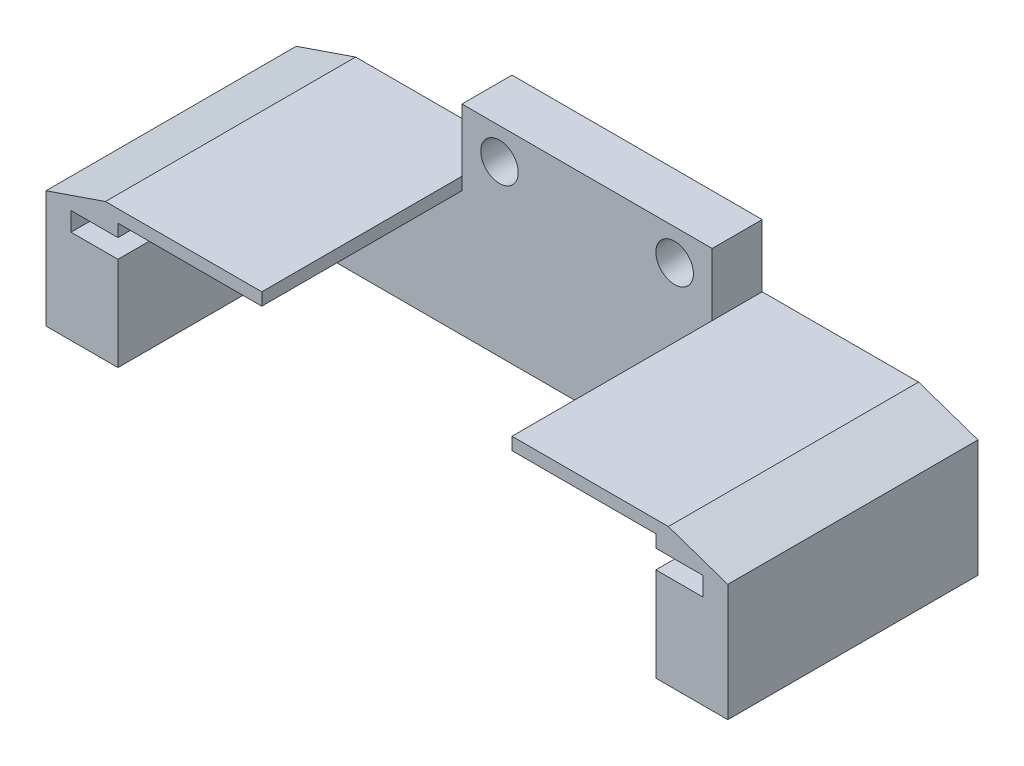
from build123d import *

# Parameters (mm, degrees)
CROQUIS1_W              = 51
CROQUIS1_H              = 17
SALIENTE_EXTRUIR1_DEPTH = 17
CROQUIS2_W              = 15
CROQUIS2_H              = 16
CORTAR_EXTRUIR1_DEPTH   = 17
CROQUIS3_W              = 43
CROQUIS3_H              = 10
CORTAR_EXTRUIR2_DEPTH   = 16
CROQUIS6_W              = 50.5
CROQUIS6_H              = 1.5
CORTAR_EXTRUIR4_DEPTH   = 16
CORTAR_EXTRUIR5_START   = -17
CROQUIS7_W              = 6
CROQUIS7_H              = 6
CROQUIS7_W_2            = 20
CROQUIS7_H_2            = 7
CORTAR_EXTRUIR5_DEPTH   = 17
CORTAR_EXTRUIR6_START   = -39
CROQUIS8_W              = 10
CROQUIS8_H              = 6
CORTAR_EXTRUIR6_DEPTH   = 39
CROQUIS10_W             = 17
CROQUIS10_H             = 11
SALIENTE_EXTRUIR4_DEPTH = 1
CROQUIS11_W             = 17
CROQUIS11_H             = 11
SALIENTE_EXTRUIR5_DEPTH = 1
CORTAR_EXTRUIR7_START   = -17
CORTAR_EXTRUIR7_DEPTH   = 17
CROQUIS13_W             = 9.5
CROQUIS13_H             = 6
CORTAR_EXTRUIR8_DEPTH   = 7
SALIENTE_EXTRUIR6_DEPTH = 3
CROQUIS16_W             = 20
CROQUIS16_H             = 4
SALIENTE_EXTRUIR7_DEPTH = 6
CROQUIS17_R             = 1.5
CORTAR_EXTRUIR9_DEPTH   = 4
CROQUIS20_W             = 20
CROQUIS20_H             = 9.628571429
SALIENTE_EXTRUIR8_DEPTH = 0.75
CROQUIS21_W             = 20
CROQUIS21_H             = 9.628571429
SALIENTE_EXTRUIR9_DEPTH = 0.75
CORTAR_EXTRUIR10_START  = -20
CORTAR_EXTRUIR10_DEPTH  = 20


with BuildPart() as part:
    # Croquis1 → Saliente-Extruir1 (new body)
    with BuildSketch(Plane.XY):
        with Locations((-29.407991935, 18.612308998)):
            Rectangle(CROQUIS1_W, CROQUIS1_H)
    extrude(amount=SALIENTE_EXTRUIR1_DEPTH)

    # Croquis2 → Cortar-Extruir1 (cut)
    with BuildSketch(Plane.XZ.offset(-10.112308998)):
        with Locations((-29.407991935, 9)):
            Rectangle(CROQUIS2_W, CROQUIS2_H)
    extrude(amount=-CORTAR_EXTRUIR1_DEPTH, mode=Mode.SUBTRACT)

    # Croquis3 → Cortar-Extruir2 (cut)
    with BuildSketch(Plane.XY.offset(17)):
        with Locations((-29.407991935, 15.112308998)):
            Rectangle(CROQUIS3_W, CROQUIS3_H)
    extrude(amount=-CORTAR_EXTRUIR2_DEPTH, mode=Mode.SUBTRACT)

    # Croquis6 → Cortar-Extruir4 (cut)
    with BuildSketch(Plane.XY.offset(17)):
        with Locations((-29.407991935, 18.362308998)):
            Rectangle(CROQUIS6_W, CROQUIS6_H)
    extrude(amount=-CORTAR_EXTRUIR4_DEPTH, mode=Mode.SUBTRACT)

    # Croquis7 → Cortar-Extruir5 (cut)
    with BuildSketch(Plane.XY.offset(17).offset(CORTAR_EXTRUIR5_START)):
        with Locations((-6.907991935, 24.112308998)):
            Rectangle(CROQUIS7_W, CROQUIS7_H)
        with Locations((-51.907991935, 24.112308998)):
            Rectangle(CROQUIS7_W, CROQUIS7_H)
        with Locations((-29.407991935, 23.612308998)):
            Rectangle(CROQUIS7_W_2, CROQUIS7_H_2)
    extrude(amount=CORTAR_EXTRUIR5_DEPTH, mode=Mode.SUBTRACT)

    # Croquis8 → Cortar-Extruir6 (cut)
    with BuildSketch(Plane(origin=(-9.907991935, 0, 0), x_dir=(0, 0, -1), z_dir=(1, 0, 0)).offset(CORTAR_EXTRUIR6_START)):
        with Locations((-5, 24.112308998)):
            Rectangle(CROQUIS8_W, CROQUIS8_H)
    extrude(amount=CORTAR_EXTRUIR6_DEPTH, mode=Mode.SUBTRACT)

    # Croquis10 → Saliente-Extruir4 (add)
    with BuildSketch(Plane.ZY.offset(54.907991935)):
        with Locations((8.5, 15.612308998)):
            Rectangle(CROQUIS10_W, CROQUIS10_H)
    extrude(amount=SALIENTE_EXTRUIR4_DEPTH)

    # Croquis11 → Saliente-Extruir5 (add)
    with BuildSketch(Plane(origin=(-3.907991935, 0, 0), x_dir=(0, 0, -1), z_dir=(1, 0, 0))):
        with Locations((-8.5, 15.612308998)):
            Rectangle(CROQUIS11_W, CROQUIS11_H)
    extrude(amount=SALIENTE_EXTRUIR5_DEPTH)

    # Croquis12 → Cortar-Extruir7 (cut)
    with BuildSketch(Plane.XY.offset(17).offset(CORTAR_EXTRUIR7_START)):
        Polygon((-55.907991935, 21.112308998), (-51.907991935, 21.112308998), (-55.907991935, 19.740880427), align=None)
        Polygon((-2.907991935, 21.112308998), (-6.907991935, 21.112308998), (-2.907991935, 19.740880427), align=None)
    extrude(amount=CORTAR_EXTRUIR7_DEPTH, mode=Mode.SUBTRACT)

    # Croquis13 → Cortar-Extruir8 (cut)
    with BuildSketch(Plane.XY.offset(17)):
        with Locations((-44.157991935, 24.112308998)):
            Rectangle(CROQUIS13_W, CROQUIS13_H)
        with Locations((-14.657991935, 24.112308998)):
            Rectangle(CROQUIS13_W, CROQUIS13_H)
    extrude(amount=-CORTAR_EXTRUIR8_DEPTH, mode=Mode.SUBTRACT)

    # Croquis14 → Saliente-Extruir6 (add)
    with BuildSketch(Plane(origin=(0, 0, 0), x_dir=(-1, 0, 0), z_dir=(0, 0, -1))):
        Polygon((55.907991935, 10.112308998), (55.907991935, 19.740880427), (51.907991935, 21.112308998), (39.407991935, 21.112308998), (39.407991935, 20.112308998), (19.407991935, 20.112308998), (19.407991935, 21.112308998), (6.907991935, 21.112308998), (2.907991935, 19.740880427), (2.907991935, 10.112308998), align=None)
    extrude(amount=SALIENTE_EXTRUIR6_DEPTH)

    # Croquis16 → Saliente-Extruir7 (add)
    with BuildSketch(Plane(origin=(0, 20.112308998, 0), x_dir=(1, 0, 0), z_dir=(0, 1, 0))):
        with Locations((-29.407991935, 1)):
            Rectangle(CROQUIS16_W, CROQUIS16_H)
    extrude(amount=SALIENTE_EXTRUIR7_DEPTH)

    # Croquis17 → Cortar-Extruir9 (cut)
    with BuildSketch(Plane.XY.offset(1)):
        with Locations((-22.407991935, 23.612308998)):
            Circle(CROQUIS17_R)
        with Locations((-36.407991935, 23.612308998)):
            Circle(CROQUIS17_R)
    extrude(amount=-CORTAR_EXTRUIR9_DEPTH, mode=Mode.SUBTRACT)

    # Croquis20 → Saliente-Extruir8 (add)
    with BuildSketch(Plane.ZY.offset(55.907991935)):
        with Locations((7, 14.926594713)):
            Rectangle(CROQUIS20_W, CROQUIS20_H)
    extrude(amount=SALIENTE_EXTRUIR8_DEPTH)

    # Croquis21 → Saliente-Extruir9 (add)
    with BuildSketch(Plane(origin=(-2.907991935, 0, 0), x_dir=(0, 0, -1), z_dir=(1, 0, 0))):
        with Locations((-7, 14.926594713)):
            Rectangle(CROQUIS21_W, CROQUIS21_H)
    extrude(amount=SALIENTE_EXTRUIR9_DEPTH)

    # Croquis22 → Cortar-Extruir10 (cut)
    with BuildSketch(Plane.XY.offset(17).offset(CORTAR_EXTRUIR10_START)):
        Polygon((-56.657991935, 19.48373757), (-56.657991935, 19.740880427), (-55.907991935, 19.740880427), align=None)
        Polygon((-2.157991935, 19.48373757), (-2.157991935, 19.740880427), (-2.907991935, 19.740880427), align=None)
    extrude(amount=CORTAR_EXTRUIR10_DEPTH, mode=Mode.SUBTRACT)


solid = part.part
